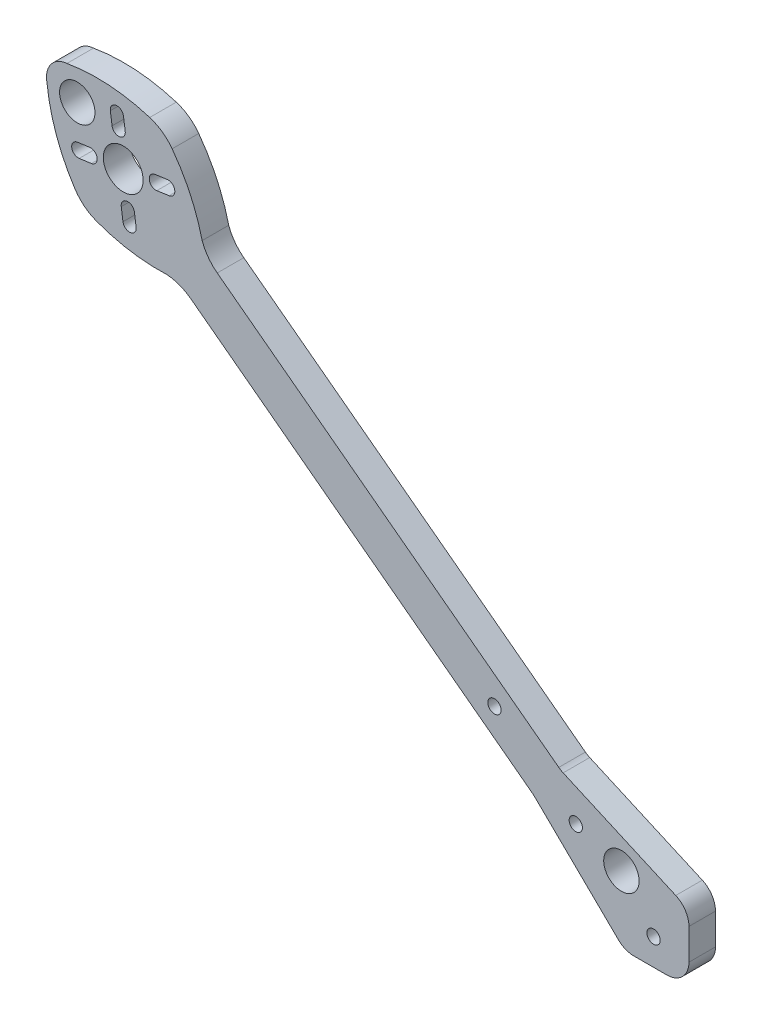
from build123d import *

# Parameters (mm, degrees)
CROQUIS1_R              = 1.5
CROQUIS1_R_2            = 4
CROQUIS1_R_3            = 4.5
SALIENTE_EXTRUIR1_DEPTH = 6


with BuildPart() as part:
    # Croquis1 → Saliente-Extruir1 (new body)
    with BuildSketch(Plane.XY):
        with BuildLine():
            ThreePointArc((-141.730339063, 56.412363794), (-138.194805157, 57.876829888), (-136.730339063, 61.412363794))
            Line((-136.730339063, 61.412363794), (-136.730339063, 68.408394616))
            ThreePointArc((-136.730339063, 68.408394616), (-137.539641754, 71.135674591), (-139.705561488, 72.980076558))
            Line((-139.705561488, 72.980076558), (-165.141293909, 84.245449184))
            ThreePointArc((-165.141293909, 84.245449184), (-165.650008995, 84.506514587), (-166.12559145, 84.823953575))
            Line((-166.12559145, 84.823953575), (-243.282498112, 142.965853083))
            ThreePointArc((-243.282498112, 142.965853083), (-245.323514753, 145.031918552), (-246.684791002, 147.597323475))
            ThreePointArc((-246.684791002, 147.597323475), (-249.33333249, 155.226277836), (-253.46024382, 162.167770437))
            ThreePointArc((-253.46024382, 162.167770437), (-255.706791789, 164.36963499), (-258.526200935, 165.764668091))
            ThreePointArc((-258.526200935, 165.764668091), (-267.807267276, 167.484933762), (-277.233031605, 166.98246665))
            ThreePointArc((-277.233031605, 166.98246665), (-280.839635864, 165.006508056), (-281.744934312, 160.994969527))
            ThreePointArc((-281.744934312, 160.994969527), (-279.629843944, 151.795844616), (-275.418009863, 143.348480526))
            ThreePointArc((-275.418009863, 143.348480526), (-273.299883496, 141.022813744), (-270.564082899, 139.470209357))
            ThreePointArc((-270.564082899, 139.470209357), (-262.753961023, 137.416502238), (-254.690502443, 136.973385563))
            ThreePointArc((-254.690502443, 136.973385563), (-251.84925837, 136.371964278), (-249.300648344, 134.979497983))
            Line((-249.300648344, 134.979497983), (-172.090396499, 76.797399996))
            ThreePointArc((-172.090396499, 76.797399996), (-171.839715997, 76.595527407), (-171.602543042, 76.377944673))
            Line((-171.602543042, 76.377944673), (-152.656110988, 57.838641566))
            ThreePointArc((-152.656110988, 57.838641566), (-151.047487061, 56.782643978), (-149.159182416, 56.412363794))
            Line((-149.159182416, 56.412363794), (-141.730339063, 56.412363794))
        make_face()
        with Locations((-144.716694163, 62.430514025)):
            Circle(CROQUIS1_R, mode=Mode.SUBTRACT)
        with Locations((-162.290622468, 75.673418875)):
            Circle(CROQUIS1_R, mode=Mode.SUBTRACT)
        with Locations((-151.980339063, 71.662363794)):
            Circle(CROQUIS1_R_2, mode=Mode.SUBTRACT)
        with Locations((-180.655292115, 89.512190067)):
            Circle(CROQUIS1_R, mode=Mode.SUBTRACT)
        with BuildLine():
            Line((-271.680758131, 150.180525793), (-274.453508724, 149.79084111))
            ThreePointArc((-274.453508724, 149.79084111), (-276.147670478, 151.067483562), (-274.871028026, 152.761645316))
            Line((-274.871028026, 152.761645316), (-272.098277434, 153.151329999))
            ThreePointArc((-272.098277434, 153.151329999), (-270.404115679, 151.874687547), (-271.680758131, 150.180525793))
        make_face(mode=Mode.SUBTRACT)
        with Locations((-264.51202067, 152.702767498)):
            Circle(CROQUIS1_R_3, mode=Mode.SUBTRACT)
        with BuildLine():
            Line((-261.989778965, 145.534030037), (-261.600094282, 142.761279445))
            ThreePointArc((-261.600094282, 142.761279445), (-262.876736734, 141.06711769), (-264.570898489, 142.343760142))
            Line((-264.570898489, 142.343760142), (-264.960583171, 145.116510734))
            ThreePointArc((-264.960583171, 145.116510734), (-263.68394072, 146.810672489), (-261.989778965, 145.534030037))
        make_face(mode=Mode.SUBTRACT)
        with Locations((-274.894282301, 160.526362799)):
            Circle(CROQUIS1_R_2, mode=Mode.SUBTRACT)
        with BuildLine():
            Line((-267.034262376, 159.871504959), (-267.423947058, 162.644255551))
            ThreePointArc((-267.423947058, 162.644255551), (-266.147304607, 164.338417306), (-264.453142852, 163.061774854))
            Line((-264.453142852, 163.061774854), (-264.063458169, 160.289024262))
            ThreePointArc((-264.063458169, 160.289024262), (-265.340100621, 158.594862507), (-267.034262376, 159.871504959))
        make_face(mode=Mode.SUBTRACT)
        with BuildLine():
            Line((-257.34328321, 155.225009203), (-254.570532617, 155.614693886))
            ThreePointArc((-254.570532617, 155.614693886), (-252.876370863, 154.338051434), (-254.153013314, 152.64388968))
            Line((-254.153013314, 152.64388968), (-256.925763907, 152.254204997))
            ThreePointArc((-256.925763907, 152.254204997), (-258.619925661, 153.530847449), (-257.34328321, 155.225009203))
        make_face(mode=Mode.SUBTRACT)
    extrude(amount=SALIENTE_EXTRUIR1_DEPTH)


solid = part.part
